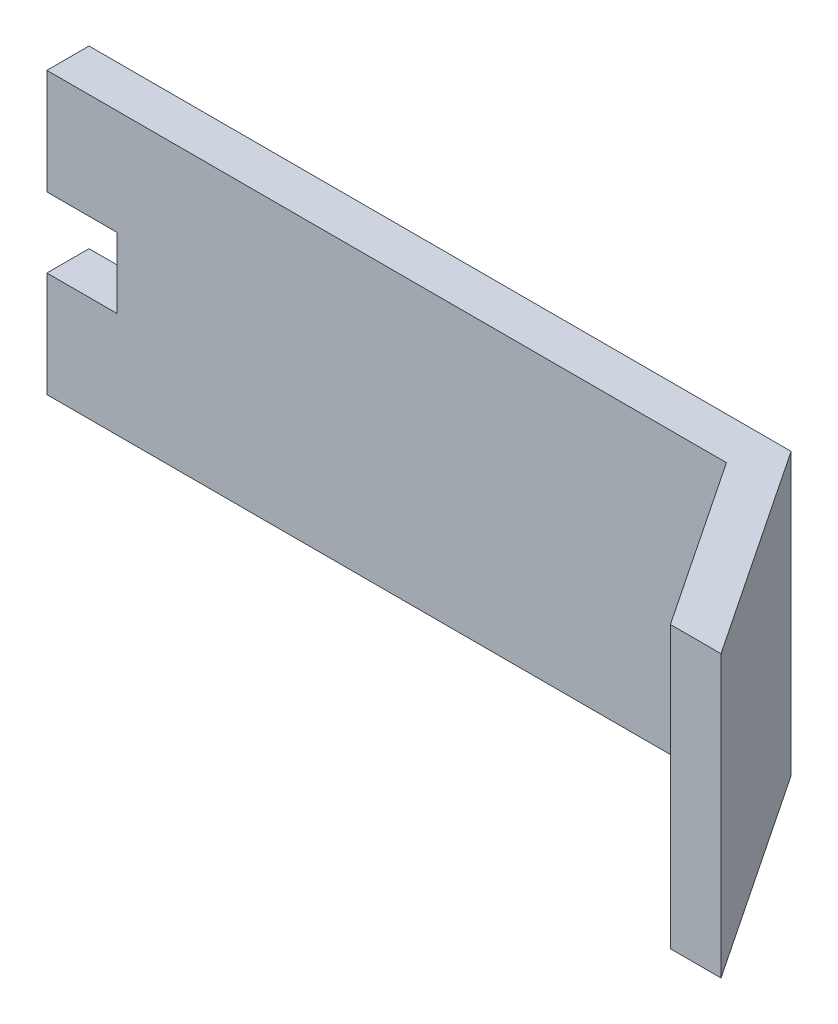
from build123d import *

# Parameters (mm, degrees)
BOSS_EXTRUDE1_DEPTH = 20
SKETCH2_W           = 5
SKETCH2_H           = 5
CUT_EXTRUDE1_DEPTH  = 10


with BuildPart() as part:
    # Sketch1 → Boss-Extrude1 (new body)
    with BuildSketch(Plane(origin=(0, 0, 0), x_dir=(1, 0, 0), z_dir=(0, 1, 0))):
        Polygon((0, 0), (0, 3), (50, 3), (59.984585881, -11.976917065), (56.379037438, -11.976917065), (48.39444645, 0), align=None)
    extrude(amount=BOSS_EXTRUDE1_DEPTH)

    # Sketch2 → Cut-Extrude1 (cut)
    with BuildSketch(Plane(origin=(0, 0, -3), x_dir=(-1, 0, 0), z_dir=(0, 0, -1))):
        with Locations((-2.5, 10)):
            Rectangle(SKETCH2_W, SKETCH2_H)
    extrude(amount=-CUT_EXTRUDE1_DEPTH, mode=Mode.SUBTRACT)


solid = part.part
